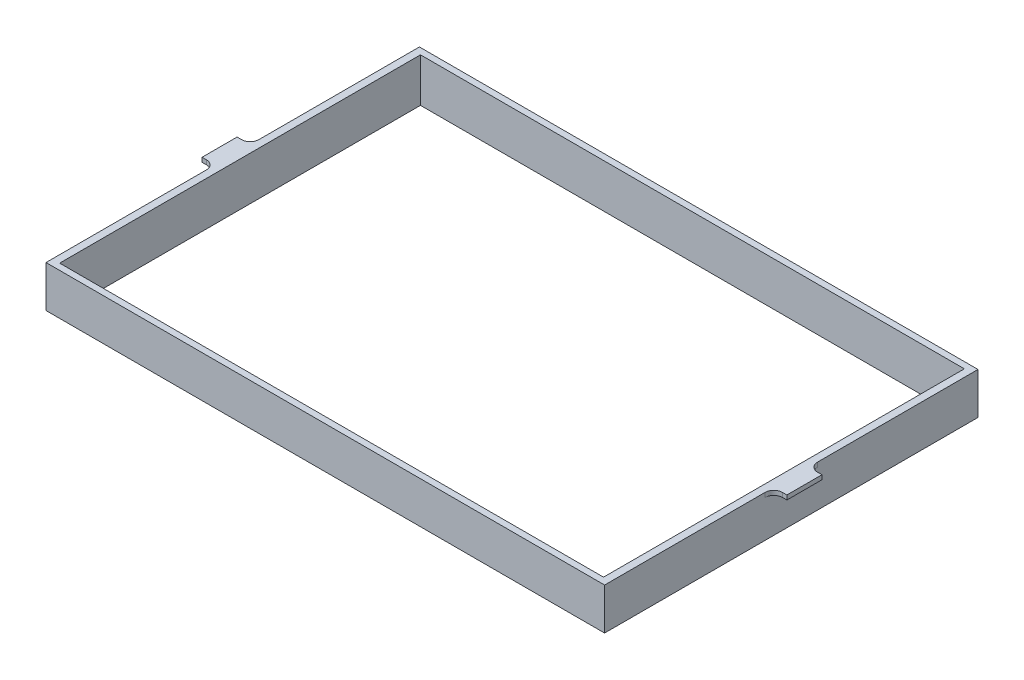
from build123d import *

# Parameters (mm, degrees)
SKETCH2_W           = 127.56
SKETCH2_H           = 85.27
SKETCH2_W_2         = 124.2
SKETCH2_H_2         = 82.4
BOSS_EXTRUDE1_DEPTH = 10
SKETCH3_W           = 8
SKETCH3_H           = 1
BOSS_EXTRUDE2_DEPTH = 3
CHAMFER1_SIZE       = 0.5
FILLET1_R           = 2


with BuildPart() as part:
    # Sketch2 → Boss-Extrude1 (new body)
    with BuildSketch(Plane(origin=(0, 0, 0), x_dir=(1, 0, 0), z_dir=(0, 1, 0))):
        Rectangle(SKETCH2_W, SKETCH2_H)
        Rectangle(SKETCH2_W_2, SKETCH2_H_2, mode=Mode.SUBTRACT)
    extrude(amount=BOSS_EXTRUDE1_DEPTH)

    # Sketch3 → Boss-Extrude2 (add)
    with BuildSketch(Plane.ZY.offset(63.78)):
        with Locations((0, 9.5)):
            Rectangle(SKETCH3_W, SKETCH3_H)
    boss_extrude2 = extrude(amount=BOSS_EXTRUDE2_DEPTH)

    # Chamfer1
    chamfer1_edges = [part.edges().sort_by_distance(p)[0] for p in [
        (0, 0, 42.635),
        (-63.78, 0, 0),
        (0, 0, -42.635),
        (63.78, 0, 0),
    ]]
    chamfer(chamfer1_edges, length=CHAMFER1_SIZE)

    # Mirror1: Boss-Extrude2 across plane
    add(boss_extrude2.mirror(Plane(origin=(0, 0, 0), x_dir=(0, 0, 1), z_dir=(1, 0, 0))))

    # Fillet1
    fillet1_edges = [part.edges().sort_by_distance(p)[0] for p in [
        (-63.78, 9.5, -4),
        (-63.78, 9.5, 4),
        (63.78, 9.5, -4),
        (63.78, 9.5, 4),
    ]]
    fillet(fillet1_edges, radius=FILLET1_R)


solid = part.part
